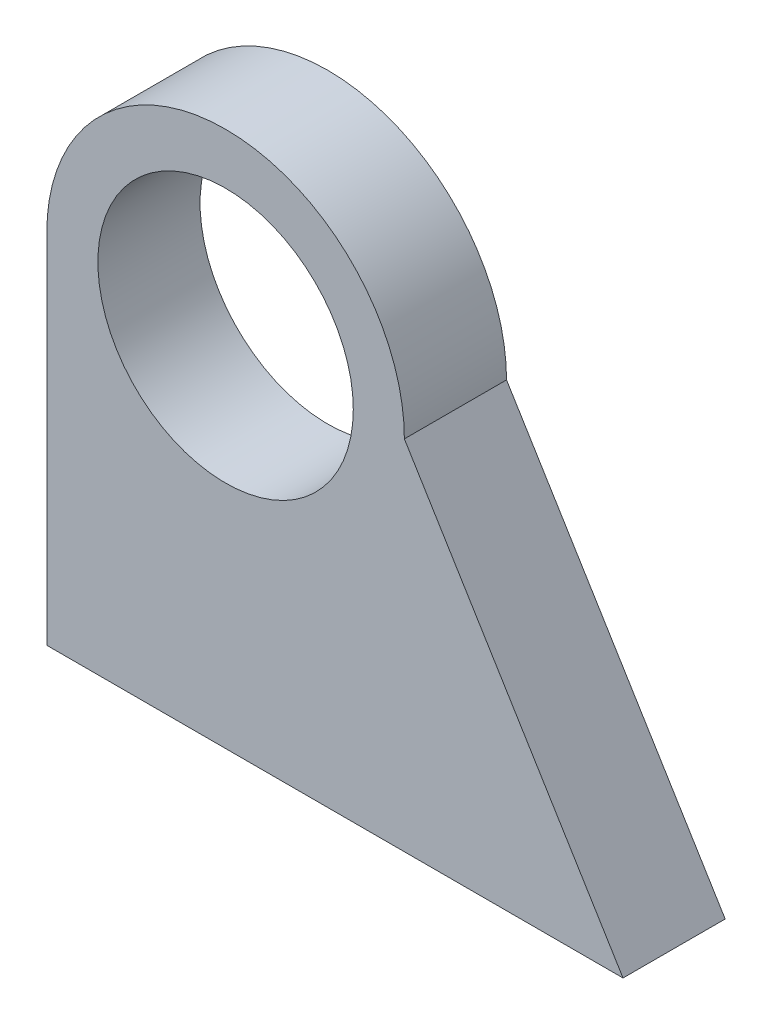
from build123d import *

# Parameters (mm, degrees)
SKETCH1_R           = 12.5
BOSS_EXTRUDE1_DEPTH = 10


with BuildPart() as part:
    # Sketch1 → Boss-Extrude1 (new body)
    with BuildSketch(Plane.XY):
        with BuildLine():
            Line((0, 35), (0, 0))
            Line((0, 0), (56.402439024, 0))
            Line((56.402439024, 0), (35, 35))
            ThreePointArc((35, 35), (17.5, 52.5), (0, 35))
        make_face()
        with Locations((17.5, 35)):
            Circle(SKETCH1_R, mode=Mode.SUBTRACT)
    extrude(amount=BOSS_EXTRUDE1_DEPTH)


solid = part.part
